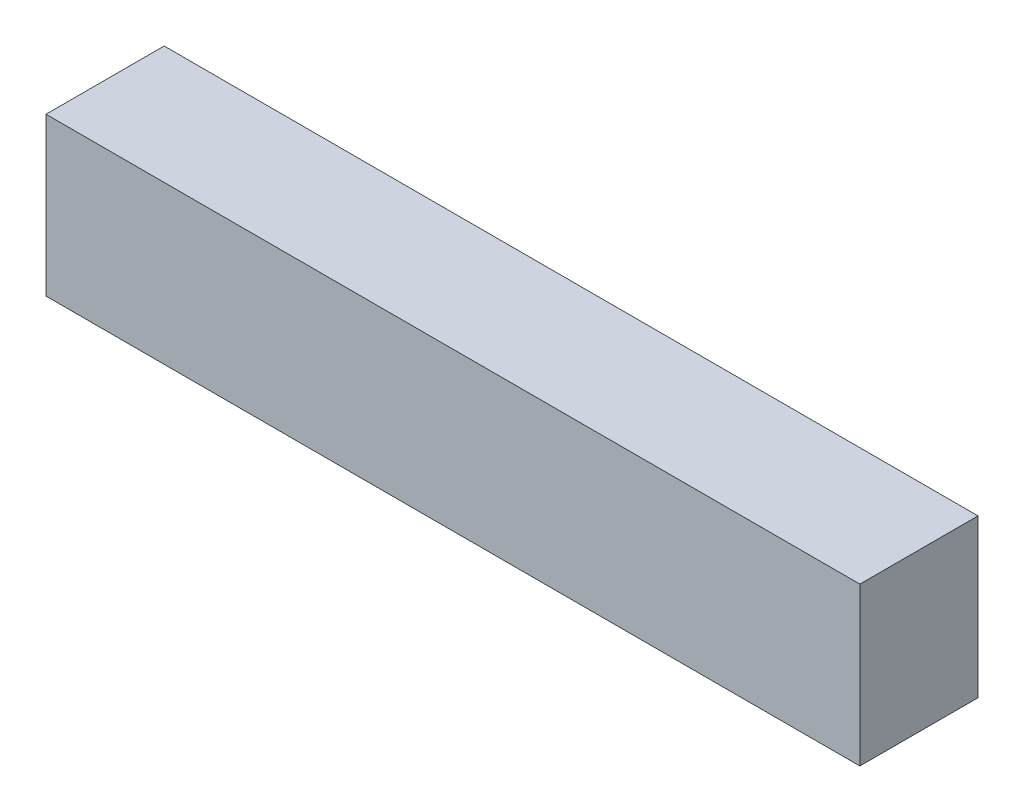
from build123d import *

# Parameters (mm, degrees)
CAR_BODY_DEPTH      = 900
GRILLE_DUCT_START   = -50
SKETCH2_W           = 235
SKETCH2_H           = 350
GRILLE_DUCT_DEPTH   = 500
FLOOR_EXIT_START    = 300
SKETCH3_W           = 235
SKETCH3_H           = 375
FLOOR_EXIT_DEPTH    = 150
RADIATOR_START      = 200
SKETCH4_W           = 225
SKETCH4_H           = 350
RADIATOR_DEPTH      = 25
RADIATOR_TOOL_START = 200
SKETCH5_W           = 225
SKETCH5_H           = 350
RADIATOR_TOOL_DEPTH = 25
FLUID_DOMAIN_START  = -9000
SKETCH6_W           = 4500
SKETCH6_H           = 6000
FLUID_DOMAIN_DEPTH  = 31000


with BuildPart() as part:
    # Sketch1 → car_body (new body)
    with BuildSketch(Plane.XY):
        with BuildLine():
            Line((300, 150), (4400, 150))
            Line((4400, 150), (4400, 1126.953873476))
            Line((4400, 1126.953873476), (3600, 1500))
            Line((3600, 1500), (300, 1500))
            ThreePointArc((300, 1500), (87.867965644, 1412.132034356), (0, 1200))
            Line((0, 1200), (0, 450))
            ThreePointArc((0, 450), (87.867965644, 237.867965644), (300, 150))
        make_face()
    extrude(amount=CAR_BODY_DEPTH)


with BuildPart() as body_2:
    # Sketch2 → grille_duct (new body)
    with BuildSketch(Plane(origin=(0, 0, 0), x_dir=(0, 0, -1), z_dir=(1, 0, 0)).offset(GRILLE_DUCT_START)):
        with Locations((-107.5, 645)):
            Rectangle(SKETCH2_W, SKETCH2_H)
    extrude(amount=GRILLE_DUCT_DEPTH)


with BuildPart() as part_1:
    add(part.part)

    # Combine1: cut body 2
    add(body_2.part, mode=Mode.SUBTRACT)


with BuildPart() as body_2_2:
    # Sketch3 → floor_exit (new body)
    with BuildSketch(Plane(origin=(0, 0, 0), x_dir=(0, 0, -1), z_dir=(1, 0, 0)).offset(FLOOR_EXIT_START)):
        with Locations((-107.5, 287.5)):
            Rectangle(SKETCH3_W, SKETCH3_H)
    extrude(amount=FLOOR_EXIT_DEPTH)


with BuildPart() as part_2:
    add(part_1.part)

    # Combine2: cut body 2 2
    add(body_2_2.part, mode=Mode.SUBTRACT)


with BuildPart() as body_2_3:
    # Sketch4 → radiator (new body)
    with BuildSketch(Plane(origin=(0, 0, 0), x_dir=(0, 0, -1), z_dir=(1, 0, 0)).offset(RADIATOR_START)):
        with Locations((-112.5, 645)):
            Rectangle(SKETCH4_W, SKETCH4_H)
    extrude(amount=RADIATOR_DEPTH)


with BuildPart() as body_3:
    # Sketch5 → radiator_tool (new body)
    with BuildSketch(Plane(origin=(0, 0, 0), x_dir=(0, 0, -1), z_dir=(1, 0, 0)).offset(RADIATOR_TOOL_START)):
        with Locations((-112.5, 645)):
            Rectangle(SKETCH5_W, SKETCH5_H)
    extrude(amount=RADIATOR_TOOL_DEPTH)


with BuildPart() as body_4:
    # Sketch6 → fluid_domain (new body)
    with BuildSketch(Plane(origin=(0, 0, 0), x_dir=(0, 0, -1), z_dir=(1, 0, 0)).offset(FLUID_DOMAIN_START)):
        with Locations((-2250, 3000)):
            Rectangle(SKETCH6_W, SKETCH6_H)
    extrude(amount=FLUID_DOMAIN_DEPTH)

    # Combine3: cut part
    add(part_2.part, mode=Mode.SUBTRACT)

    # Combine4: cut body 3
    add(body_3.part, mode=Mode.SUBTRACT)


solid = Compound([body_2_3.part, body_4.part])
